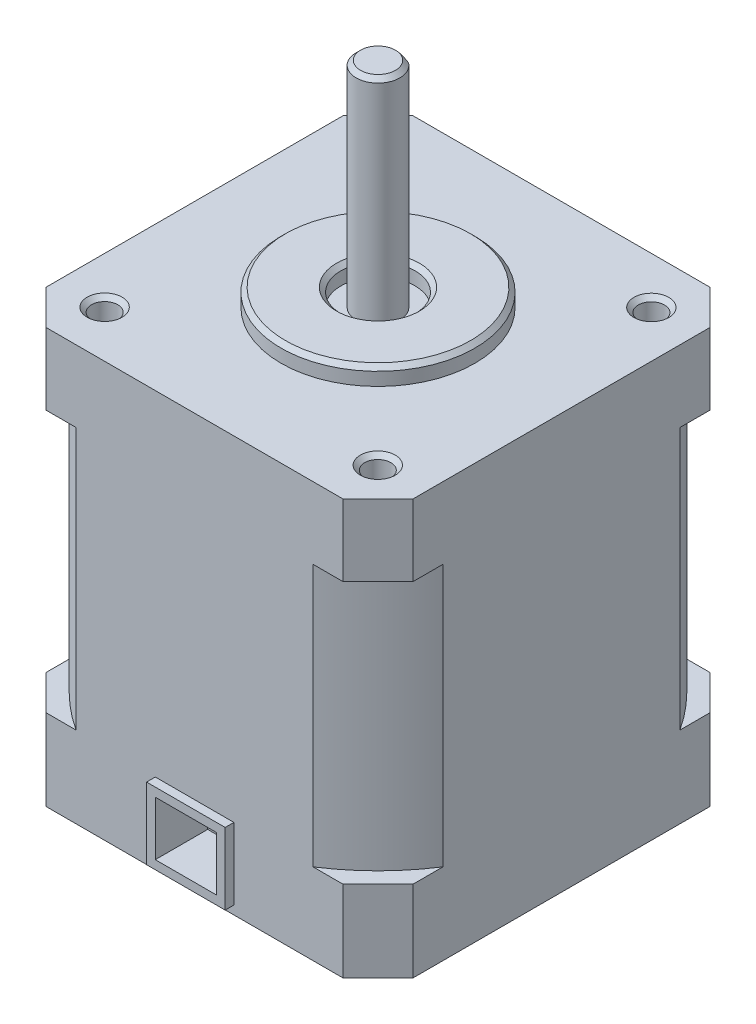
from build123d import *

# Parameters (mm, degrees)
SKETCH1_W           = 42
SKETCH1_H           = 42
BOSS_EXTRUDE1_DEPTH = 47.5
CHAMFER1_SIZE       = 4
SKETCH2_R           = 11.1
SKETCH2_R_2         = 4.25
BOSS_EXTRUDE2_DEPTH = 2
SKETCH4_R           = 2.5
BOSS_EXTRUDE3_DEPTH = 24.5
CHAMFER2_SIZE       = 0.5
CUT_EXTRUDE1_DEPTH  = 18
SKETCH6_R           = 1.5
CUT_EXTRUDE2_DEPTH  = 5
CUT_EXTRUDE3_START  = 9.3
SKETCH7_R           = 36.852304789
SKETCH7_R_2         = 25
CUT_EXTRUDE3_DEPTH  = 30
SKETCH8_W           = 9
SKETCH8_H           = 8.197254607
SKETCH8_W_2         = 7
SKETCH8_H_2         = 6.197254607
EXTRUDE_THIN1_DEPTH = 1
SKETCH9_W           = 7
SKETCH9_H           = 6.197254607
CUT_EXTRUDE4_DEPTH  = 5
CHAMFER3_SIZE       = 0.5


with BuildPart() as part:
    # Sketch1 → Boss-Extrude1 (new body)
    with BuildSketch(Plane(origin=(0, 0, 0), x_dir=(1, 0, 0), z_dir=(0, 1, 0))):
        Rectangle(SKETCH1_W, SKETCH1_H)
    extrude(amount=BOSS_EXTRUDE1_DEPTH)

    # Chamfer1
    chamfer1_edges = [part.edges().sort_by_distance(p)[0] for p in [
        (21, 23.75, 21),
        (-21, 23.75, 21),
        (-21, 23.75, -21),
        (21, 23.75, -21),
    ]]
    chamfer(chamfer1_edges, length=CHAMFER1_SIZE)

    # Sketch2 → Boss-Extrude2 (add)
    with BuildSketch(Plane.XZ.offset(-47.5)):
        with Locations(Location((0, 0, 0), (0, 0, 270))):
            Circle(SKETCH2_R)
        with Locations(Location((0, 0, 0), (0, 0, 270))):
            Circle(SKETCH2_R_2, mode=Mode.SUBTRACT)
    extrude(amount=-BOSS_EXTRUDE2_DEPTH)

    # Sketch4 → Boss-Extrude3 (add)
    with BuildSketch(Plane(origin=(0, 47.5, 0), x_dir=(1, 0, 0), z_dir=(0, 1, 0))):
        with Locations(Location((0, 0, 0), (0, 0, 270))):
            Circle(SKETCH4_R)
    extrude(amount=BOSS_EXTRUDE3_DEPTH)

    # Chamfer2
    chamfer2_edges = [part.edges().sort_by_distance(p)[0] for p in [
        (0, 72, -2.5),
    ]]
    chamfer(chamfer2_edges, length=CHAMFER2_SIZE)

    # Sketch5 → Cut-Extrude1 (cut)
    with BuildSketch(Plane(origin=(0, 72, 0), x_dir=(1, 0, 0), z_dir=(0, 1, 0))):
        Polygon((-1.867188484, 2), (1.973628394, 2), (0.053219955, 2.996371605), align=None)
    extrude(amount=-CUT_EXTRUDE1_DEPTH, mode=Mode.SUBTRACT)

    # Sketch6 → Cut-Extrude2 (cut)
    with BuildSketch(Plane(origin=(0, 47.5, 0), x_dir=(1, 0, 0), z_dir=(0, 1, 0))):
        with Locations(Location((-15.637811111, 15.662146765, 0), (0, 0, 270))):
            Circle(SKETCH6_R)
        with Locations(Location((15.662146765, 15.637811111, 0), (0, 0, 270))):
            Circle(SKETCH6_R)
        with Locations(Location((15.637811111, -15.662146765, 0), (0, 0, 270))):
            Circle(SKETCH6_R)
        with Locations(Location((-15.662146765, -15.637811111, 0), (0, 0, 270))):
            Circle(SKETCH6_R)
    extrude(amount=-CUT_EXTRUDE2_DEPTH, mode=Mode.SUBTRACT)

    # Sketch7 → Cut-Extrude3 (cut)
    with BuildSketch(Plane(origin=(0, 0, 0), x_dir=(1, 0, 0), z_dir=(0, 1, 0)).offset(CUT_EXTRUDE3_START)):
        Circle(SKETCH7_R)
        Circle(SKETCH7_R_2, mode=Mode.SUBTRACT)
    extrude(amount=CUT_EXTRUDE3_DEPTH, mode=Mode.SUBTRACT)

    # Sketch8 → Extrude-Thin1 (add)
    with BuildSketch(Plane.XY.offset(21)):
        with Locations((0, 5.081594665)):
            Rectangle(SKETCH8_W, SKETCH8_H)
        with Locations((0, 5.081594665)):
            Rectangle(SKETCH8_W_2, SKETCH8_H_2, mode=Mode.SUBTRACT)
    extrude(amount=EXTRUDE_THIN1_DEPTH)

    # Sketch9 → Cut-Extrude4 (cut)
    with BuildSketch(Plane.XY.offset(21)):
        with Locations((0, 5.081594665)):
            Rectangle(SKETCH9_W, SKETCH9_H)
    extrude(amount=-CUT_EXTRUDE4_DEPTH, mode=Mode.SUBTRACT)

    # Chamfer3
    chamfer3_edges = [part.edges().sort_by_distance(p)[0] for p in [
        (0, 49.5, 11.1),
        (0, 49.5, 4.25),
        (-15.637811111, 47.5, -17.162146765),
        (15.662146765, 47.5, -17.137811111),
        (15.637811111, 47.5, 14.162146765),
        (-15.662146765, 47.5, 14.137811111),
    ]]
    chamfer(chamfer3_edges, length=CHAMFER3_SIZE)


solid = part.part
